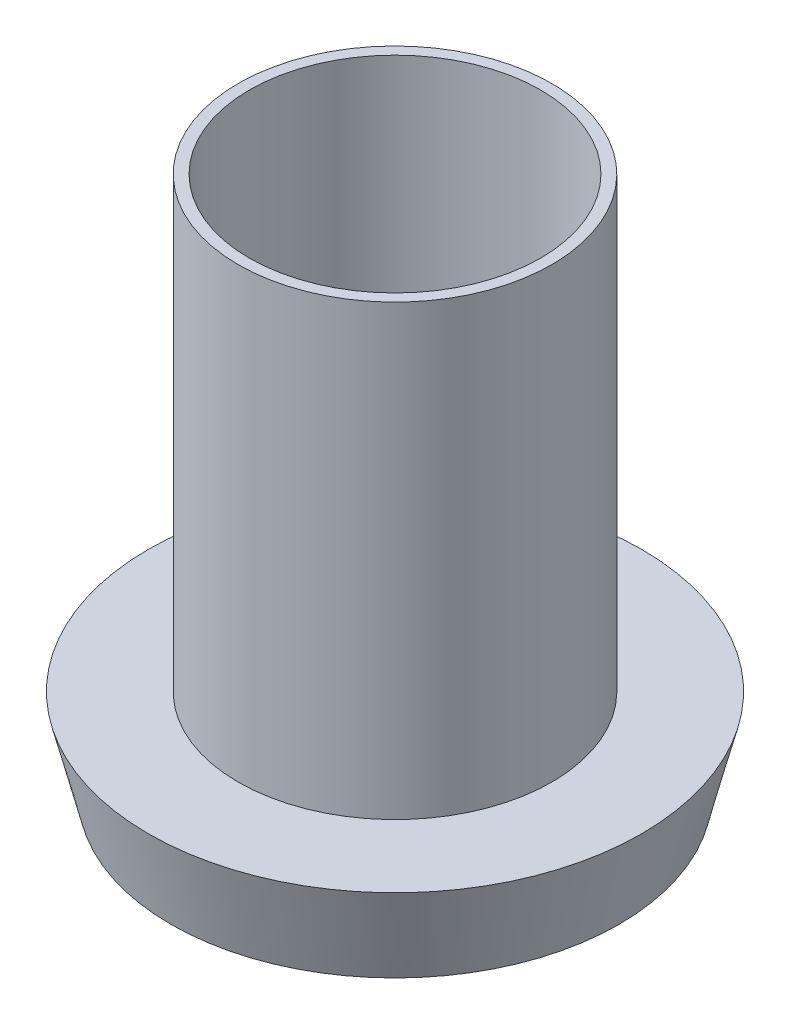
from build123d import *

# Parameters (mm, degrees)
SKETCH2_R           = 5
SKETCH1_R           = 5.5
SKETCH3_R           = 0.5
CUT_EXTRUDE1_DEPTH  = 9.031189364
SKETCH4_R           = 3.5
SKETCH4_R_2         = 3.25
BOSS_EXTRUDE1_DEPTH = 10
SKETCH5_R           = 0.75
SKETCH5_R_2         = 0.25
BOSS_EXTRUDE2_DEPTH = 2


with BuildPart() as part:
    # Sketch2 → Loft1 section 0
    with BuildSketch(Plane(origin=(0, -2, 0), x_dir=(1, 0, 0), z_dir=(0, 1, 0))):
        Circle(SKETCH2_R)
    # Sketch1 → Loft1 section 1
    with BuildSketch(Plane(origin=(0, 0, 0), x_dir=(1, 0, 0), z_dir=(0, 1, 0))):
        Circle(SKETCH1_R)
    loft()

    # Sketch3 → Cut-Extrude1 (cut, through all)
    with BuildSketch(Plane(origin=(0, 0, 0), x_dir=(1, 0, 0), z_dir=(0, 1, 0))):
        with Locations(Location((0, 0, 0), (0, 0, 270))):
            Circle(SKETCH3_R)
    extrude(amount=-CUT_EXTRUDE1_DEPTH, mode=Mode.SUBTRACT)

    # Sketch4 → Boss-Extrude1 (add)
    with BuildSketch(Plane(origin=(0, 0, 0), x_dir=(1, 0, 0), z_dir=(0, 1, 0))):
        with Locations(Location((0, 0, 0), (0, 0, 270))):
            Circle(SKETCH4_R)
        with Locations(Location((0, 0, 0), (0, 0, 270))):
            Circle(SKETCH4_R_2, mode=Mode.SUBTRACT)
    extrude(amount=BOSS_EXTRUDE1_DEPTH)

    # Sketch5 → Boss-Extrude2 (add)
    with BuildSketch(Plane(origin=(0, 0, 0), x_dir=(1, 0, 0), z_dir=(0, 1, 0))):
        with Locations(Location((0, 0, 0), (0, 0, 270))):
            Circle(SKETCH5_R)
        with Locations(Location((0, 0, 0), (0, 0, 270))):
            Circle(SKETCH5_R_2, mode=Mode.SUBTRACT)
    extrude(amount=BOSS_EXTRUDE2_DEPTH)


solid = part.part
